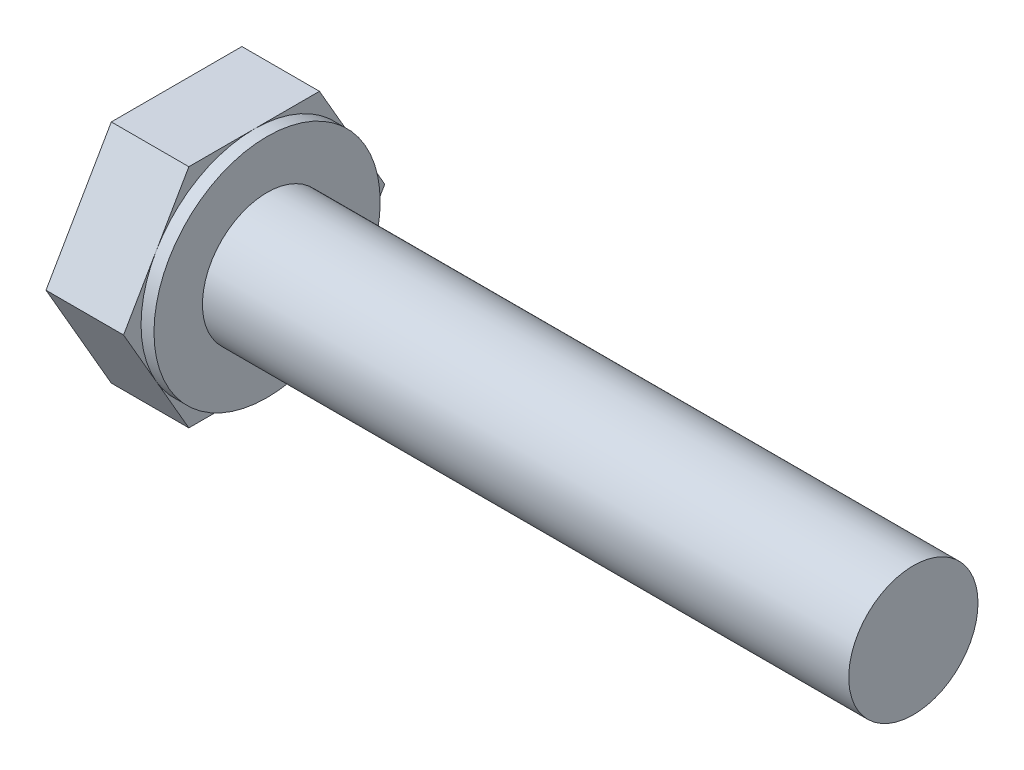
from build123d import *

# Parameters (mm, degrees)
BOSS_EXTRUDE1_DEPTH = 2.4
SKETCH2_R           = 3.5
BOSS_EXTRUDE2_DEPTH = 0.4
SKETCH3_R           = 2
BOSS_EXTRUDE3_DEPTH = 20


with BuildPart() as part:
    # Sketch1 → Boss-Extrude1 (new body)
    with BuildSketch(Plane(origin=(0, 0, 0), x_dir=(0, 0, -1), z_dir=(1, 0, 0))):
        Polygon((-4.041451884, 0), (-2.020725942, -3.5), (2.020725942, -3.5), (4.041451884, 0), (2.020725942, 3.5), (-2.020725942, 3.5), align=None)
    extrude(amount=-BOSS_EXTRUDE1_DEPTH)

    # Sketch2 → Boss-Extrude2 (add)
    with BuildSketch(Plane(origin=(0, 0, 0), x_dir=(0, 0, -1), z_dir=(1, 0, 0))):
        with Locations(Location((0, 0, 0), (0, 0, 150))):
            Circle(SKETCH2_R)
    extrude(amount=BOSS_EXTRUDE2_DEPTH)

    # Sketch3 → Boss-Extrude3 (add)
    with BuildSketch(Plane(origin=(0.4, 0, 0), x_dir=(0, 0, -1), z_dir=(1, 0, 0))):
        Circle(SKETCH3_R)
    extrude(amount=BOSS_EXTRUDE3_DEPTH)


solid = part.part
